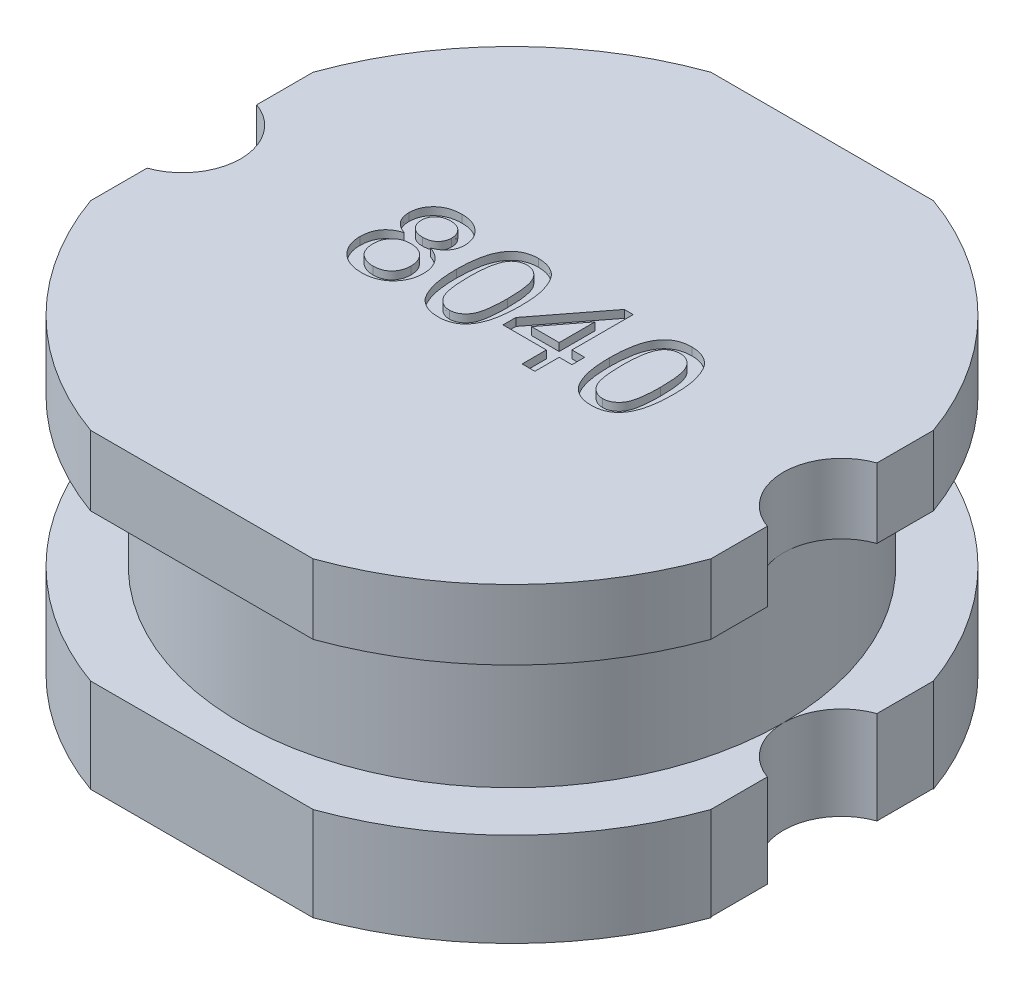
from build123d import *

# Parameters (mm, degrees)
EXTRUDE_1_DEPTH     = 4
SKETCH_2_W          = 0.75
SKETCH_2_H          = 1.9
EXTRUDE_START       = 0.01
EXTRUDE_2_DEPTH     = 0.01
CUT_EXTRUDE_1_DEPTH = 0.1


with BuildPart() as part:
    # Эскиз1 → Бобышка-Вытянуть1 (new body)
    with BuildSketch(Plane(origin=(0, 0, 0), x_dir=(1, 0, 0), z_dir=(0, 1, 0))):
        with BuildLine():
            Line((-1.436140662, 4), (1.436140662, 4))
            ThreePointArc((1.436140662, 4), (3.00520382, 3.00520382), (4, 1.436140662))
            Line((4, 1.436140662), (4, 0.707106781))
            ThreePointArc((4, 0.707106781), (3.5, 0), (4, -0.707106781))
            Line((4, -0.707106781), (4, -1.436140662))
            ThreePointArc((4, -1.436140662), (3.00520382, -3.00520382), (1.436140662, -4))
            Line((1.436140662, -4), (-1.436140662, -4))
            ThreePointArc((-1.436140662, -4), (-3.00520382, -3.00520382), (-4, -1.436140662))
            Line((-4, -1.436140662), (-4, -0.707106781))
            ThreePointArc((-4, -0.707106781), (-3.5, 0), (-4, 0.707106781))
            Line((-4, 0.707106781), (-4, 1.436140662))
            ThreePointArc((-4, 1.436140662), (-3.00520382, 3.00520382), (-1.436140662, 4))
        make_face()
    extrude(amount=EXTRUDE_1_DEPTH)

    # Эскиз2 → Вырез-Повернуть1 (revolve, cut)
    with BuildSketch(Plane(origin=(0, 0, 0), x_dir=(0, 0, -1), z_dir=(1, 0, 0)), mode=Mode.PRIVATE) as cut_revolve_1_sk:
        with Locations((-3.875, 2.15)):
            Rectangle(SKETCH_2_W, SKETCH_2_H)
    revolve(cut_revolve_1_sk.sketch.rotate(Axis((0, 0, 0), (0, 1, 0)), 90), axis=Axis((0, 0, 0), (0, 1, 0)), mode=Mode.SUBTRACT)

    # Эскиз3 → Бобышка-Вытянуть2 (add)
    with BuildSketch(Plane.XZ.offset(EXTRUDE_START)):
        with BuildLine():
            Line((-4, 1.436140662), (4, 1.436140662))
            ThreePointArc((4, 1.436140662), (3.00520382, 3.00520382), (1.436140662, 4))
            Line((1.436140662, 4), (-1.436140662, 4))
            ThreePointArc((-1.436140662, 4), (-3.00520382, 3.00520382), (-4, 1.436140662))
        make_face()
        with BuildLine():
            Line((-1.436140662, -4), (1.436140662, -4))
            ThreePointArc((1.436140662, -4), (3.00520382, -3.00520382), (4, -1.436140662))
            Line((4, -1.436140662), (-4, -1.436140662))
            ThreePointArc((-4, -1.436140662), (-3.00520382, -3.00520382), (-1.436140662, -4))
        make_face()
    extrude(amount=-EXTRUDE_2_DEPTH)

    # Эскиз4 → Вырез-Вытянуть1 (cut)
    # profile 1 of 4: a face of its own
    with BuildSketch(Plane(origin=(0, 4, 0), x_dir=(1, 0, 0), z_dir=(0, 1, 0))):
        with BuildLine():
            add(Edge.make_bspline(
                [(-1.619229134, 0.228668215), (-1.634850166, 0.234779251), (-1.664800863, 0.246496134), (-1.705196632, 0.269944914), (-1.739385194, 0.296919647), (-1.766946757, 0.328070812), (-1.78795368, 0.362754428), (-1.803079494, 0.400528281), (-1.811938949, 0.441602813), (-1.813104956, 0.470004794), (-1.813705188, 0.484625456)],
                knots=[0, 0, 0, 0, 1.16287356, 2.229614231, 3.228817875, 4.173350329, 5.100165549, 6.029633206, 6.985702163, 8, 8, 8, 8], degree=3))
            add(Edge.make_bspline(
                [(-1.813705188, 0.484625456), (-1.813422687, 0.495875411), (-1.812868128, 0.517959425), (-1.80807661, 0.550363976), (-1.800402305, 0.581415642), (-1.78951067, 0.611026785), (-1.775865236, 0.63944113), (-1.758647, 0.666138114), (-1.738855706, 0.691872248), (-1.715671147, 0.71560328), (-1.690122163, 0.737338609), (-1.662448627, 0.756680917), (-1.63243878, 0.772498222), (-1.600592971, 0.785722822), (-1.566753738, 0.796076286), (-1.530801883, 0.803127572), (-1.492864143, 0.807612712), (-1.466868302, 0.808196304), (-1.453564347, 0.80849497)],
                knots=[0, 0, 0, 0, 0.994101948, 1.951453197, 2.889123786, 3.817215529, 4.736003873, 5.669743943, 6.620499649, 7.601567446, 8.596478358, 9.582687259, 10.579761808, 11.589151689, 12.62747492, 13.702346593, 14.8241243, 16, 16, 16, 16], degree=3))
            add(Edge.make_bspline(
                [(-1.453564347, 0.80849497), (-1.440175618, 0.808193271), (-1.414095885, 0.807605597), (-1.375956589, 0.803180719), (-1.339777854, 0.795764348), (-1.30558098, 0.785242385), (-1.273312055, 0.771789421), (-1.243183118, 0.755253963), (-1.214884009, 0.735908733), (-1.189138044, 0.713523031), (-1.165712285, 0.689219439), (-1.145416078, 0.663182066), (-1.128008666, 0.636018476), (-1.113624056, 0.607563644), (-1.102982267, 0.577493546), (-1.094870835, 0.546374716), (-1.090165829, 0.513837402), (-1.089597253, 0.491757448), (-1.089307611, 0.480509561)],
                knots=[0, 0, 0, 0, 1.171211919, 2.281388661, 3.353996503, 4.398126828, 5.406889753, 6.407389155, 7.400009931, 8.40008733, 9.387021643, 10.349004252, 11.283445052, 12.206096336, 13.131640667, 14.068727932, 15.016178647, 16, 16, 16, 16], degree=3))
            add(Edge.make_bspline(
                [(-1.089307611, 0.480509561), (-1.089778125, 0.46639281), (-1.090700716, 0.438712516), (-1.100102325, 0.398811142), (-1.114755538, 0.36156121), (-1.135933851, 0.327672638), (-1.162755398, 0.296795434), (-1.196038799, 0.269953542), (-1.235278584, 0.246541409), (-1.264473073, 0.234786321), (-1.279667769, 0.228668215)],
                knots=[0, 0, 0, 0, 0.998680737, 1.958225066, 2.887911823, 3.823713378, 4.77537694, 5.772726054, 6.840782926, 8, 8, 8, 8], degree=3))
            add(Edge.make_bspline(
                [(-1.279667769, 0.228668215), (-1.270080903, 0.225413928), (-1.251294803, 0.219036938), (-1.224736863, 0.206638103), (-1.199733361, 0.193269215), (-1.176143299, 0.178797387), (-1.154837445, 0.162146381), (-1.135104972, 0.144300704), (-1.117028845, 0.125008875), (-1.100855965, 0.104106814), (-1.086416876, 0.08203322), (-1.074055871, 0.058734276), (-1.063557906, 0.034541614), (-1.054585984, 0.009343046), (-1.048032704, -0.017038924), (-1.043447462, -0.044483055), (-1.040538255, -0.072844708), (-1.04012615, -0.092107323), (-1.039916867, -0.101889628)],
                knots=[0, 0, 0, 0, 1.104208047, 2.163768705, 3.193778962, 4.198696312, 5.179575955, 6.14024585, 7.100368562, 8.060719304, 9.021161243, 9.975749006, 10.935506756, 11.897452199, 12.89163552, 13.897859372, 14.932451246, 16, 16, 16, 16], degree=3))
            add(Edge.make_bspline(
                [(-1.039916867, -0.101889628), (-1.040244045, -0.115372294), (-1.040888612, -0.141934174), (-1.046551977, -0.180923897), (-1.055120899, -0.218378846), (-1.067615377, -0.254140797), (-1.08357393, -0.288235032), (-1.103314853, -0.320612041), (-1.126644184, -0.351238519), (-1.15287375, -0.380209663), (-1.182198388, -0.406398322), (-1.213922215, -0.42947631), (-1.248164262, -0.448807066), (-1.284509056, -0.464812864), (-1.323130629, -0.477217297), (-1.363979335, -0.485903031), (-1.40704158, -0.491075003), (-1.43648621, -0.491772268), (-1.451506399, -0.492127954)],
                knots=[0, 0, 0, 0, 1.017598406, 2.004746413, 2.969099523, 3.915171376, 4.859468899, 5.806714415, 6.772805022, 7.762836953, 8.753334612, 9.736396794, 10.719437652, 11.716790048, 12.730404696, 13.776887535, 14.865953843, 16, 16, 16, 16], degree=3))
            add(Edge.make_bspline(
                [(-1.451506399, -0.492127954), (-1.466525086, -0.491764602), (-1.495966771, -0.49105231), (-1.539068361, -0.485986071), (-1.579858622, -0.47690659), (-1.618429978, -0.464489548), (-1.654991663, -0.44891711), (-1.689003742, -0.429150782), (-1.720934789, -0.406102033), (-1.750279817, -0.379751389), (-1.776727258, -0.350783335), (-1.799749057, -0.319704551), (-1.819372789, -0.28699333), (-1.835522694, -0.25246527), (-1.847832604, -0.216120057), (-1.856471845, -0.178094144), (-1.862145461, -0.138416588), (-1.862774644, -0.111341961), (-1.863095932, -0.097516489)],
                knots=[0, 0, 0, 0, 1.127066097, 2.209429196, 3.250843736, 4.258219581, 5.246860502, 6.227045772, 7.204057202, 8.19754525, 9.181483529, 10.142920909, 11.095356922, 12.039670968, 12.998174893, 13.969127444, 14.962948905, 16, 16, 16, 16], degree=3))
            add(Edge.make_bspline(
                [(-1.863095932, -0.097516489), (-1.862872613, -0.087222397), (-1.862434421, -0.067023606), (-1.859757659, -0.037397477), (-1.854422922, -0.009160661), (-1.847551442, 0.01785324), (-1.838826811, 0.043711807), (-1.828063319, 0.068211974), (-1.81500443, 0.091294526), (-1.800168676, 0.11310966), (-1.783368847, 0.133504226), (-1.764877228, 0.152299624), (-1.744626651, 0.16928207), (-1.723072181, 0.184947569), (-1.699310332, 0.19818799), (-1.6742248, 0.210338542), (-1.647384298, 0.220700711), (-1.62870818, 0.225985782), (-1.619229134, 0.228668215)],
                knots=[0, 0, 0, 0, 1.117345089, 2.192424383, 3.22371675, 4.232639188, 5.215561493, 6.182180952, 7.132172269, 8.089790513, 9.041830748, 9.996006267, 10.94686322, 11.907506267, 12.882866327, 13.894317773, 14.931262935, 16, 16, 16, 16], degree=3))
        make_face()
        with BuildLine():
            add(Edge.make_bspline(
                [(-1.649069375, 0.483853726), (-1.648580738, 0.470747561), (-1.647636474, 0.445420636), (-1.637367503, 0.409445594), (-1.621309813, 0.377129919), (-1.602484989, 0.353695339), (-1.58443671, 0.337728147), (-1.569372936, 0.327067421), (-1.552911145, 0.318016679), (-1.534932077, 0.310981872), (-1.515871187, 0.304749471), (-1.495071092, 0.301266012), (-1.473020685, 0.298434167), (-1.457776725, 0.298229075), (-1.449962939, 0.298123949)],
                knots=[0, 0, 0, 0, 1.528727296, 2.954179336, 4.335216052, 5.725683216, 6.435919001, 7.148062981, 7.879427438, 8.626027458, 9.402978632, 10.2190538, 11.08711833, 12, 12, 12, 12], degree=3))
            add(Edge.make_bspline(
                [(-1.449962939, 0.298123949), (-1.442321635, 0.29823296), (-1.427421511, 0.298445526), (-1.405867732, 0.301219638), (-1.385499486, 0.304924726), (-1.366617756, 0.310539217), (-1.349004553, 0.317839693), (-1.332946348, 0.326839378), (-1.317962603, 0.337182599), (-1.300444516, 0.353271779), (-1.28164567, 0.375885587), (-1.265534167, 0.406757675), (-1.255494163, 0.440533574), (-1.254469412, 0.464060455), (-1.253943424, 0.476136422)],
                knots=[0, 0, 0, 0, 0.922112375, 1.798068639, 2.620552757, 3.419964248, 4.17189205, 4.918165909, 5.639229138, 6.36503528, 7.785020832, 9.165298717, 10.544993853, 12, 12, 12, 12], degree=3))
            add(Edge.make_bspline(
                [(-1.253943424, 0.476136422), (-1.254577166, 0.48863453), (-1.255817235, 0.513090092), (-1.265832713, 0.548197152), (-1.282694649, 0.579993664), (-1.301957073, 0.603214207), (-1.319785054, 0.620036123), (-1.3350378, 0.630744399), (-1.35143456, 0.639858089), (-1.369037739, 0.647300644), (-1.387872792, 0.653303142), (-1.407990741, 0.65724107), (-1.42930705, 0.660002877), (-1.443950914, 0.660213874), (-1.451506399, 0.660322738)],
                knots=[0, 0, 0, 0, 1.480633456, 2.897216237, 4.289382554, 5.720567045, 6.454675042, 7.191244726, 7.924224627, 8.676083236, 9.454506446, 10.26432127, 11.104478565, 12, 12, 12, 12], degree=3))
            add(Edge.make_bspline(
                [(-1.451506399, 0.660322738), (-1.459062725, 0.660217395), (-1.473793414, 0.660012034), (-1.49524872, 0.65716735), (-1.515557327, 0.653594486), (-1.534531873, 0.647860698), (-1.552093488, 0.640367972), (-1.568425604, 0.631249163), (-1.583649451, 0.620814412), (-1.601602686, 0.604742613), (-1.620405742, 0.582128292), (-1.636970705, 0.551749268), (-1.647208388, 0.518625878), (-1.648441363, 0.495588006), (-1.649069375, 0.483853726)],
                knots=[0, 0, 0, 0, 0.914830409, 1.783417199, 2.618873138, 3.411020283, 4.179090249, 4.927874451, 5.674348476, 6.410336976, 7.841713217, 9.213201474, 10.580551314, 12, 12, 12, 12], degree=3))
        make_face(mode=Mode.SUBTRACT)
        with BuildLine():
            add(Edge.make_bspline(
                [(-1.698460119, -0.094429568), (-1.698175427, -0.104993503), (-1.697605292, -0.126149201), (-1.692603982, -0.157569896), (-1.684117795, -0.18840548), (-1.673241269, -0.21868508), (-1.657899254, -0.247186557), (-1.637554015, -0.272626223), (-1.612024551, -0.29401436), (-1.582868508, -0.31208387), (-1.551051768, -0.326306129), (-1.517897795, -0.336233748), (-1.484262275, -0.342793424), (-1.461568845, -0.343568245), (-1.450220182, -0.343955722)],
                knots=[0, 0, 0, 0, 0.957879255, 1.91828174, 2.876792425, 3.856375228, 4.831004356, 5.799187063, 6.79220414, 7.836856316, 8.902268238, 9.943090861, 10.971368942, 12, 12, 12, 12], degree=3))
            add(Edge.make_bspline(
                [(-1.450220182, -0.343955722), (-1.440861986, -0.343797201), (-1.422681679, -0.34348924), (-1.396180484, -0.339970124), (-1.371210367, -0.334630473), (-1.347656928, -0.327308938), (-1.325866847, -0.317292592), (-1.305485283, -0.305585659), (-1.286720713, -0.291436935), (-1.269578448, -0.275289669), (-1.254233082, -0.257427767), (-1.241087836, -0.238158678), (-1.229621082, -0.218024297), (-1.220259002, -0.196590093), (-1.213488709, -0.173811868), (-1.208264472, -0.15010059), (-1.205112844, -0.12521169), (-1.204742107, -0.108244043), (-1.20455268, -0.099574437)],
                knots=[0, 0, 0, 0, 1.149387474, 2.232932207, 3.278773642, 4.285224938, 5.256757121, 6.220082341, 7.168479488, 8.137608443, 9.109140627, 10.056190326, 10.999892409, 11.953252726, 12.923240661, 13.915357002, 14.934853301, 16, 16, 16, 16], degree=3))
            add(Edge.make_bspline(
                [(-1.20455268, -0.099574437), (-1.20474814, -0.090734657), (-1.20513082, -0.073427776), (-1.208202355, -0.047992616), (-1.213719534, -0.023864173), (-1.220814649, -0.000677937), (-1.230430559, 0.021162719), (-1.241973112, 0.041970962), (-1.25610805, 0.061198335), (-1.271608138, 0.079497609), (-1.289149046, 0.096062682), (-1.308519699, 0.11034737), (-1.329106197, 0.122963169), (-1.3515313, 0.132640552), (-1.375300953, 0.140392356), (-1.400528081, 0.146024935), (-1.427315542, 0.149467981), (-1.445664834, 0.149787358), (-1.455107808, 0.149951717)],
                knots=[0, 0, 0, 0, 1.065858887, 2.086781919, 3.082735321, 4.047496077, 5.006086125, 5.955204095, 6.910833714, 7.878747924, 8.844339535, 9.812198509, 10.776903849, 11.749116737, 12.749729282, 13.788304076, 14.861809717, 16, 16, 16, 16], degree=3))
            add(Edge.make_bspline(
                [(-1.455107808, 0.149951717), (-1.464294351, 0.149785723), (-1.482302837, 0.149460321), (-1.508464188, 0.145997772), (-1.533230951, 0.140680446), (-1.556385225, 0.13289783), (-1.57821651, 0.123172662), (-1.598325521, 0.110943958), (-1.617071, 0.096749922), (-1.63388034, 0.080252055), (-1.649046721, 0.062330886), (-1.662159681, 0.043119448), (-1.673743653, 0.023063389), (-1.682534484, 0.001504596), (-1.689975136, -0.020859974), (-1.69462672, -0.044464394), (-1.697933415, -0.069040476), (-1.698281985, -0.085842842), (-1.698460119, -0.094429568)],
                knots=[0, 0, 0, 0, 1.135239447, 2.225422834, 3.256957183, 4.262780498, 5.240265059, 6.205773948, 7.16638056, 8.141101257, 9.111719309, 10.064571387, 11.014055337, 11.969087385, 12.938082716, 13.92369833, 14.938921288, 16, 16, 16, 16], degree=3))
        make_face(mode=Mode.SUBTRACT)
    # profile 2 of 4: a face of its own
    with BuildSketch(Plane(origin=(0, 4, 0), x_dir=(1, 0, 0), z_dir=(0, 1, 0))):
        with BuildLine():
            add(Edge.make_bspline(
                [(-0.875281053, 0.157669021), (-0.875115183, 0.176020837), (-0.874790312, 0.211964316), (-0.872775245, 0.264556082), (-0.869257101, 0.314500305), (-0.86400548, 0.361753611), (-0.857786576, 0.406422659), (-0.849701963, 0.448443701), (-0.840605598, 0.48791102), (-0.829691592, 0.524783476), (-0.817700673, 0.559378106), (-0.804096592, 0.591639411), (-0.788790155, 0.621533189), (-0.77253358, 0.649369453), (-0.754471085, 0.674715235), (-0.735692888, 0.698281842), (-0.7148343, 0.719204994), (-0.692762667, 0.738023045), (-0.669152979, 0.754628879), (-0.644130153, 0.768957711), (-0.617790471, 0.781609037), (-0.589631928, 0.791132951), (-0.560239089, 0.79889696), (-0.529385705, 0.80460826), (-0.497037774, 0.807975263), (-0.47493251, 0.808319777), (-0.463691521, 0.80849497)],
                knots=[0, 0, 0, 0, 1.514747001, 2.966751498, 4.343369068, 5.64627492, 6.890416844, 8.064737671, 9.177176366, 10.232018008, 11.237056675, 12.19799043, 13.119080079, 14.007588942, 14.855863561, 15.685992447, 16.491747269, 17.290132607, 18.077525251, 18.870243746, 19.668095604, 20.485086593, 21.319398728, 22.175900658, 23.072407314, 24, 24, 24, 24], degree=3))
            add(Edge.make_bspline(
                [(-0.463691521, 0.80849497), (-0.447199527, 0.808010117), (-0.414800345, 0.807057604), (-0.367497372, 0.79928908), (-0.322917369, 0.785999824), (-0.281089298, 0.768072043), (-0.242728205, 0.745300312), (-0.208470132, 0.717617803), (-0.178684608, 0.685315177), (-0.153696695, 0.648009659), (-0.131854765, 0.606730384), (-0.112450874, 0.561292076), (-0.09491032, 0.511745652), (-0.082463161, 0.467394687), (-0.073584613, 0.42910936), (-0.06770772, 0.397532705), (-0.06282872, 0.363461317), (-0.059090747, 0.326977623), (-0.056023828, 0.288122543), (-0.053655387, 0.246871886), (-0.052453161, 0.203122551), (-0.05222124, 0.173104234), (-0.052101988, 0.157669021)],
                knots=[0, 0, 0, 0, 1.134486744, 2.228744715, 3.287356444, 4.328707449, 5.352829806, 6.347195599, 7.349461267, 8.364207941, 9.428085653, 10.559314403, 11.761222316, 13.04268526, 13.726896727, 14.465273606, 15.252205015, 16.094778733, 16.988606776, 17.934225168, 18.937792761, 20, 20, 20, 20], degree=3))
            add(Edge.make_bspline(
                [(-0.052101988, 0.157669021), (-0.052270965, 0.139403406), (-0.052601097, 0.103717933), (-0.054562169, 0.051547864), (-0.058292306, 0.001980445), (-0.062882308, -0.045097867), (-0.06982602, -0.089561395), (-0.077308245, -0.131599054), (-0.08656191, -0.171019955), (-0.097358764, -0.207841376), (-0.109518473, -0.242258014), (-0.122853476, -0.274529973), (-0.137623272, -0.304635199), (-0.154267466, -0.332280062), (-0.172024512, -0.357831501), (-0.191024459, -0.381385365), (-0.21167013, -0.402602647), (-0.233940663, -0.421364254), (-0.257384582, -0.438264569), (-0.282468242, -0.45273487), (-0.309081858, -0.464723262), (-0.337047612, -0.474972743), (-0.366649258, -0.482482961), (-0.39765336, -0.488231915), (-0.430174154, -0.491617316), (-0.452364918, -0.491955393), (-0.463691521, -0.492127954)],
                knots=[0, 0, 0, 0, 1.508974709, 2.94807912, 4.311757619, 5.615040294, 6.854280449, 8.028314546, 9.141715822, 10.197470207, 11.196696834, 12.155719058, 13.080757287, 13.963948316, 14.818758719, 15.649605906, 16.461113142, 17.260189315, 18.052359509, 18.845763934, 19.647754795, 20.461145776, 21.303032214, 22.167241874, 23.064524267, 24, 24, 24, 24], degree=3))
            add(Edge.make_bspline(
                [(-0.463691521, -0.492127954), (-0.478542009, -0.491704343), (-0.507496375, -0.490878418), (-0.549782091, -0.485266768), (-0.589469491, -0.47539), (-0.626893315, -0.462143861), (-0.66163291, -0.444426388), (-0.693854143, -0.422869622), (-0.724204477, -0.397975104), (-0.741675974, -0.378333901), (-0.750517976, -0.368393851)],
                knots=[0, 0, 0, 0, 1.10322584, 2.150986741, 3.161425019, 4.136713905, 5.093944212, 6.049774532, 7.013026876, 8, 8, 8, 8], degree=3))
            add(Edge.make_bspline(
                [(-0.750517976, -0.368393851), (-0.760695324, -0.353712877), (-0.781681452, -0.32344008), (-0.806243894, -0.271822154), (-0.828154028, -0.214998064), (-0.845349466, -0.151852929), (-0.85881778, -0.082889313), (-0.868545265, -0.007971894), (-0.874050065, 0.07286696), (-0.874861461, 0.128763548), (-0.875281053, 0.157669021)],
                knots=[0, 0, 0, 0, 0.779365345, 1.607084704, 2.489375761, 3.438383567, 4.461919411, 5.557722155, 6.737039282, 8, 8, 8, 8], degree=3))
        make_face()
        with BuildLine():
            add(Edge.make_bspline(
                [(-0.71064524, 0.158183508), (-0.71048177, 0.133484453), (-0.710168852, 0.086204999), (-0.706899616, 0.018658141), (-0.70127176, -0.042278345), (-0.693831367, -0.096520088), (-0.684007037, -0.144140462), (-0.671671427, -0.185018114), (-0.657766262, -0.21964367), (-0.640558883, -0.247587973), (-0.621718703, -0.270366655), (-0.602267506, -0.289957059), (-0.58174767, -0.306608454), (-0.560293087, -0.320492322), (-0.537570871, -0.331004274), (-0.513829488, -0.33862336), (-0.489063771, -0.343008027), (-0.472197193, -0.343638021), (-0.463691521, -0.343955722)],
                knots=[0, 0, 0, 0, 1.89448813, 3.626469325, 5.185477471, 6.587276848, 7.82441448, 8.910550357, 9.859733512, 10.6775885, 11.416198291, 12.123144072, 12.791880183, 13.439617036, 14.078171869, 14.70637855, 15.347637704, 16, 16, 16, 16], degree=3))
            add(Edge.make_bspline(
                [(-0.463691521, -0.343955722), (-0.455187978, -0.34363108), (-0.438325623, -0.34298732), (-0.413502683, -0.338699339), (-0.389853672, -0.330688027), (-0.367165336, -0.320213203), (-0.345554814, -0.306645791), (-0.325135757, -0.2899315), (-0.305582095, -0.270352728), (-0.286826545, -0.247309285), (-0.269750262, -0.219235787), (-0.255584253, -0.184638437), (-0.243440887, -0.143689195), (-0.233562648, -0.096093084), (-0.226091563, -0.041937101), (-0.220497734, 0.018830375), (-0.217206619, 0.086290322), (-0.216898865, 0.133484342), (-0.216737801, 0.158183508)],
                knots=[0, 0, 0, 0, 0.652509534, 1.29391342, 1.924290653, 2.562989607, 3.207355802, 3.876242846, 4.583348185, 5.32723334, 6.150888545, 7.094226006, 8.186903555, 9.424320409, 10.81992305, 12.379283064, 14.105084285, 16, 16, 16, 16], degree=3))
            add(Edge.make_bspline(
                [(-0.216737801, 0.158183508), (-0.216893708, 0.182368765), (-0.217192421, 0.228706801), (-0.220568418, 0.294952367), (-0.225858908, 0.354866058), (-0.233095459, 0.408503111), (-0.242712834, 0.455805294), (-0.254377398, 0.496873307), (-0.26827747, 0.531619567), (-0.284804606, 0.5603931), (-0.303202616, 0.583995202), (-0.32242108, 0.604424876), (-0.342940464, 0.621799648), (-0.365124309, 0.635737946), (-0.388257587, 0.646982847), (-0.412871843, 0.654721874), (-0.438725139, 0.65947649), (-0.45646792, 0.660037432), (-0.465492225, 0.660322738)],
                knots=[0, 0, 0, 0, 1.850066095, 3.544656626, 5.0727657, 6.45041401, 7.682899467, 8.762389858, 9.712573485, 10.538438529, 11.291566246, 11.996865408, 12.681389046, 13.341983376, 13.996294293, 14.643563182, 15.31009126, 16, 16, 16, 16], degree=3))
            add(Edge.make_bspline(
                [(-0.465492225, 0.660322738), (-0.473997363, 0.660099512), (-0.490768405, 0.659659338), (-0.515323407, 0.655457885), (-0.538593894, 0.648432119), (-0.560846471, 0.638915037), (-0.581525613, 0.626106924), (-0.601451404, 0.61115254), (-0.619690598, 0.592932293), (-0.630681376, 0.579311121), (-0.636301881, 0.572345475)],
                knots=[0, 0, 0, 0, 1.021318143, 2.013908504, 2.982026795, 3.937174072, 4.91255697, 5.897578595, 6.924855925, 8, 8, 8, 8], degree=3))
            add(Edge.make_bspline(
                [(-0.636301881, 0.572345475), (-0.642420896, 0.562115099), (-0.655342968, 0.540510699), (-0.669802015, 0.502961362), (-0.682574565, 0.460049617), (-0.693090609, 0.411115236), (-0.700698229, 0.35624216), (-0.706704151, 0.295494116), (-0.709824004, 0.22878629), (-0.710363942, 0.182367086), (-0.71064524, 0.158183508)],
                knots=[0, 0, 0, 0, 0.671104906, 1.417232262, 2.260109084, 3.195198885, 4.23592645, 5.382417421, 6.636286093, 8, 8, 8, 8], degree=3))
        make_face(mode=Mode.SUBTRACT)
    # profile 3 of 4: a face of its own
    with BuildSketch(Plane(origin=(0, 4, 0), x_dir=(1, 0, 0), z_dir=(0, 1, 0))):
        Polygon((0.606441265, -0.475664373), (0.606441265, -0.162856328), (0.0466795, -0.162856328), (0.0466795, 0.001779485), (0.655832009, 0.792031388), (0.771077078, 0.792031388), (0.771077078, 0.001779485), (0.935712891, 0.001779485), (0.935712891, -0.162856328), (0.771077078, -0.162856328), (0.771077078, -0.475664373), align=None)
        Polygon((0.606441265, 0.001779485), (0.606441265, 0.464303223), (0.249901832, 0.001779485), align=None, mode=Mode.SUBTRACT)
    # profile 4 of 4: a face of its own
    with BuildSketch(Plane(origin=(0, 4, 0), x_dir=(1, 0, 0), z_dir=(0, 1, 0))):
        with BuildLine():
            add(Edge.make_bspline(
                [(1.100348704, 0.157669021), (1.100514575, 0.176020837), (1.100839445, 0.211964316), (1.102854513, 0.264556082), (1.106372657, 0.314500305), (1.111624278, 0.361753611), (1.117843181, 0.406422659), (1.125927794, 0.448443701), (1.13502416, 0.48791102), (1.145938165, 0.524783476), (1.157929085, 0.559378106), (1.171533166, 0.591639411), (1.186839602, 0.621533189), (1.203096178, 0.649369453), (1.221158673, 0.674715235), (1.23993687, 0.698281842), (1.260795457, 0.719204994), (1.28286709, 0.738023045), (1.306476779, 0.754628879), (1.331499605, 0.768957711), (1.357839287, 0.781609037), (1.38599783, 0.791132951), (1.415390668, 0.79889696), (1.446244053, 0.80460826), (1.478591984, 0.807975263), (1.500697248, 0.808319777), (1.511938237, 0.80849497)],
                knots=[0, 0, 0, 0, 1.514747001, 2.966751498, 4.343369068, 5.64627492, 6.890416844, 8.064737671, 9.177176366, 10.232018008, 11.237056675, 12.19799043, 13.119080079, 14.007588942, 14.855863561, 15.685992447, 16.491747269, 17.290132607, 18.077525251, 18.870243746, 19.668095604, 20.485086593, 21.319398728, 22.175900658, 23.072407314, 24, 24, 24, 24], degree=3))
            add(Edge.make_bspline(
                [(1.511938237, 0.80849497), (1.52843023, 0.808010117), (1.560829412, 0.807057604), (1.608132386, 0.79928908), (1.652712389, 0.785999824), (1.69454046, 0.768072043), (1.732901553, 0.745300312), (1.767159626, 0.717617803), (1.79694515, 0.685315177), (1.821933063, 0.648009659), (1.843774992, 0.606730384), (1.863178883, 0.561292076), (1.880719437, 0.511745652), (1.893166596, 0.467394687), (1.902045144, 0.42910936), (1.907922038, 0.397532705), (1.912801038, 0.363461317), (1.916539011, 0.326977623), (1.91960593, 0.288122543), (1.92197437, 0.246871886), (1.923176597, 0.203122551), (1.923408518, 0.173104234), (1.92352777, 0.157669021)],
                knots=[0, 0, 0, 0, 1.134486744, 2.228744715, 3.287356444, 4.328707449, 5.352829806, 6.347195599, 7.349461267, 8.364207941, 9.428085653, 10.559314403, 11.761222316, 13.04268526, 13.726896727, 14.465273606, 15.252205015, 16.094778733, 16.988606776, 17.934225168, 18.937792761, 20, 20, 20, 20], degree=3))
            add(Edge.make_bspline(
                [(1.92352777, 0.157669021), (1.923358792, 0.139403406), (1.923028661, 0.103717933), (1.921067588, 0.051547864), (1.917337451, 0.001980445), (1.912747449, -0.045097867), (1.905803738, -0.089561395), (1.898321512, -0.131599054), (1.889067848, -0.171019955), (1.878270994, -0.207841376), (1.866111284, -0.242258014), (1.852776282, -0.274529973), (1.838006485, -0.304635199), (1.821362291, -0.332280062), (1.803605246, -0.357831501), (1.784605299, -0.381385365), (1.763959628, -0.402602647), (1.741689095, -0.421364254), (1.718245176, -0.438264569), (1.693161515, -0.45273487), (1.6665479, -0.464723262), (1.638582145, -0.474972743), (1.608980499, -0.482482961), (1.577976397, -0.488231915), (1.545455604, -0.491617316), (1.523264839, -0.491955393), (1.511938237, -0.492127954)],
                knots=[0, 0, 0, 0, 1.508974709, 2.94807912, 4.311757619, 5.615040294, 6.854280449, 8.028314546, 9.141715822, 10.197470207, 11.196696834, 12.155719058, 13.080757287, 13.963948316, 14.818758719, 15.649605906, 16.461113142, 17.260189315, 18.052359509, 18.845763934, 19.647754795, 20.461145776, 21.303032214, 22.167241874, 23.064524267, 24, 24, 24, 24], degree=3))
            add(Edge.make_bspline(
                [(1.511938237, -0.492127954), (1.497087748, -0.491704343), (1.468133383, -0.490878418), (1.425847667, -0.485266768), (1.386160267, -0.47539), (1.348736442, -0.462143861), (1.313996847, -0.444426388), (1.281775614, -0.422869622), (1.251425281, -0.397975104), (1.233953784, -0.378333901), (1.225111781, -0.368393851)],
                knots=[0, 0, 0, 0, 1.10322584, 2.150986741, 3.161425019, 4.136713905, 5.093944212, 6.049774532, 7.013026876, 8, 8, 8, 8], degree=3))
            add(Edge.make_bspline(
                [(1.225111781, -0.368393851), (1.214934433, -0.353712877), (1.193948306, -0.32344008), (1.169385863, -0.271822154), (1.14747573, -0.214998064), (1.130280292, -0.151852929), (1.116811978, -0.082889313), (1.107084492, -0.007971894), (1.101579693, 0.07286696), (1.100768297, 0.128763548), (1.100348704, 0.157669021)],
                knots=[0, 0, 0, 0, 0.779365345, 1.607084704, 2.489375761, 3.438383567, 4.461919411, 5.557722155, 6.737039282, 8, 8, 8, 8], degree=3))
        make_face()
        with BuildLine():
            add(Edge.make_bspline(
                [(1.264984517, 0.158183508), (1.265147988, 0.133484453), (1.265460906, 0.086204999), (1.268730142, 0.018658141), (1.274357998, -0.042278345), (1.28179839, -0.096520088), (1.291622721, -0.144140462), (1.30395833, -0.185018114), (1.317863496, -0.21964367), (1.335070875, -0.247587973), (1.353911054, -0.270366655), (1.373362252, -0.289957059), (1.393882087, -0.306608454), (1.415336671, -0.320492322), (1.438058886, -0.331004274), (1.461800269, -0.33862336), (1.486565986, -0.343008027), (1.503432565, -0.343638021), (1.511938237, -0.343955722)],
                knots=[0, 0, 0, 0, 1.89448813, 3.626469325, 5.185477471, 6.587276848, 7.82441448, 8.910550357, 9.859733512, 10.6775885, 11.416198291, 12.123144072, 12.791880183, 13.439617036, 14.078171869, 14.70637855, 15.347637704, 16, 16, 16, 16], degree=3))
            add(Edge.make_bspline(
                [(1.511938237, -0.343955722), (1.520441779, -0.34363108), (1.537304134, -0.34298732), (1.562127075, -0.338699339), (1.585776085, -0.330688027), (1.608464422, -0.320213203), (1.630074944, -0.306645791), (1.650494, -0.2899315), (1.670047663, -0.270352728), (1.688803213, -0.247309285), (1.705879495, -0.219235787), (1.720045505, -0.184638437), (1.732188871, -0.143689195), (1.742067109, -0.096093084), (1.749538195, -0.041937101), (1.755132024, 0.018830375), (1.758423138, 0.086290322), (1.758730892, 0.133484342), (1.758891957, 0.158183508)],
                knots=[0, 0, 0, 0, 0.652509534, 1.29391342, 1.924290653, 2.562989607, 3.207355802, 3.876242846, 4.583348185, 5.32723334, 6.150888545, 7.094226006, 8.186903555, 9.424320409, 10.81992305, 12.379283064, 14.105084285, 16, 16, 16, 16], degree=3))
            add(Edge.make_bspline(
                [(1.758891957, 0.158183508), (1.758736049, 0.182368765), (1.758437337, 0.228706801), (1.75506134, 0.294952367), (1.749770849, 0.354866058), (1.742534298, 0.408503111), (1.732916923, 0.455805294), (1.721252359, 0.496873307), (1.707352287, 0.531619567), (1.690825151, 0.5603931), (1.672427142, 0.583995202), (1.653208677, 0.604424876), (1.632689293, 0.621799648), (1.610505449, 0.635737946), (1.58737217, 0.646982847), (1.562757914, 0.654721874), (1.536904619, 0.65947649), (1.519161838, 0.660037432), (1.510137533, 0.660322738)],
                knots=[0, 0, 0, 0, 1.850066095, 3.544656626, 5.0727657, 6.45041401, 7.682899467, 8.762389858, 9.712573485, 10.538438529, 11.291566246, 11.996865408, 12.681389046, 13.341983376, 13.996294293, 14.643563182, 15.31009126, 16, 16, 16, 16], degree=3))
            add(Edge.make_bspline(
                [(1.510137533, 0.660322738), (1.501632395, 0.660099512), (1.484861353, 0.659659338), (1.460306351, 0.655457885), (1.437035863, 0.648432119), (1.414783287, 0.638915037), (1.394104145, 0.626106924), (1.374178353, 0.61115254), (1.35593916, 0.592932293), (1.344948382, 0.579311121), (1.339327877, 0.572345475)],
                knots=[0, 0, 0, 0, 1.021318143, 2.013908504, 2.982026795, 3.937174072, 4.91255697, 5.897578595, 6.924855925, 8, 8, 8, 8], degree=3))
            add(Edge.make_bspline(
                [(1.339327877, 0.572345475), (1.333208861, 0.562115099), (1.32028679, 0.540510699), (1.305827743, 0.502961362), (1.293055192, 0.460049617), (1.282539149, 0.411115236), (1.274931529, 0.35624216), (1.268925607, 0.295494116), (1.265805754, 0.22878629), (1.265265816, 0.182367086), (1.264984517, 0.158183508)],
                knots=[0, 0, 0, 0, 0.671104906, 1.417232262, 2.260109084, 3.195198885, 4.23592645, 5.382417421, 6.636286093, 8, 8, 8, 8], degree=3))
        make_face(mode=Mode.SUBTRACT)
    extrude(amount=-CUT_EXTRUDE_1_DEPTH, mode=Mode.SUBTRACT)


solid = part.part
